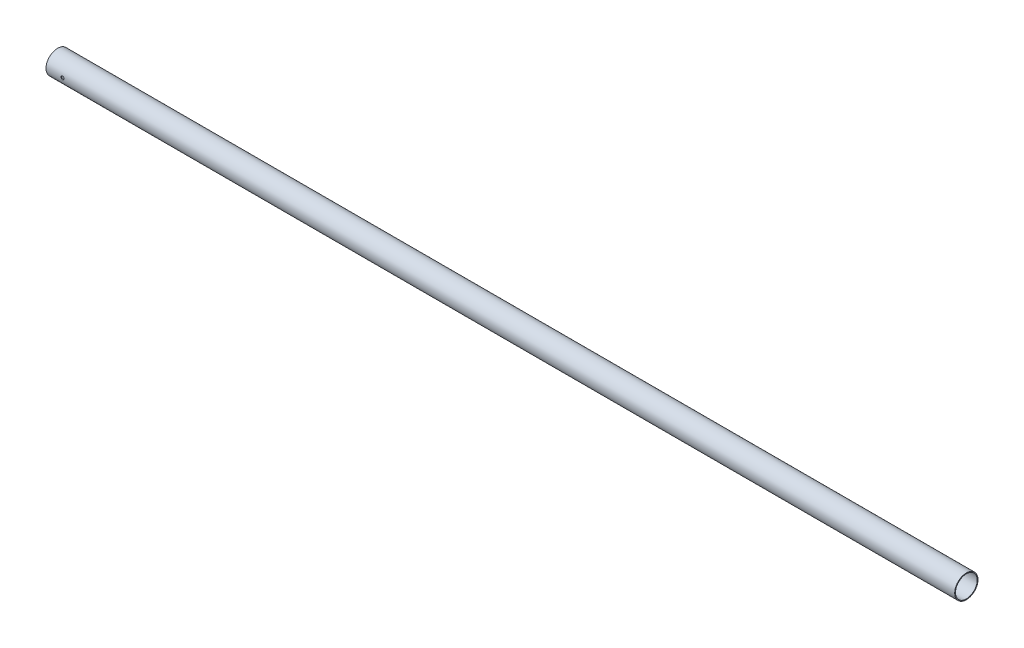
from build123d import *

# Parameters (mm, degrees)
SKETCH1_R               = 12.7
SKETCH1_R_2             = 11.811
BOSS_EXTRUDE1_DEPTH     = 991.014
CUT_EXTRUDE1_DEPTH      = 992.176739132
CUT_EXTRUDE1_DEPTH_BACK = 992.176739132
SKETCH2_R               = 1.7


with BuildPart() as part:
    # Sketch1 → Boss-Extrude1 (new body)
    with BuildSketch(Plane(origin=(0, 0, 0), x_dir=(0, 0, -1), z_dir=(1, 0, 0))):
        Circle(SKETCH1_R)
        Circle(SKETCH1_R_2, mode=Mode.SUBTRACT)
    extrude(amount=BOSS_EXTRUDE1_DEPTH)

    # Sketch2 → Cut-Extrude1 (cut, two sides: drawn at the far end of the back side and taken through both)
    with BuildSketch(Plane.XY.offset(-CUT_EXTRUDE1_DEPTH_BACK)):
        with Locations((18, 0)):
            Circle(SKETCH2_R)
    extrude(amount=CUT_EXTRUDE1_DEPTH + CUT_EXTRUDE1_DEPTH_BACK, mode=Mode.SUBTRACT)


solid = part.part
